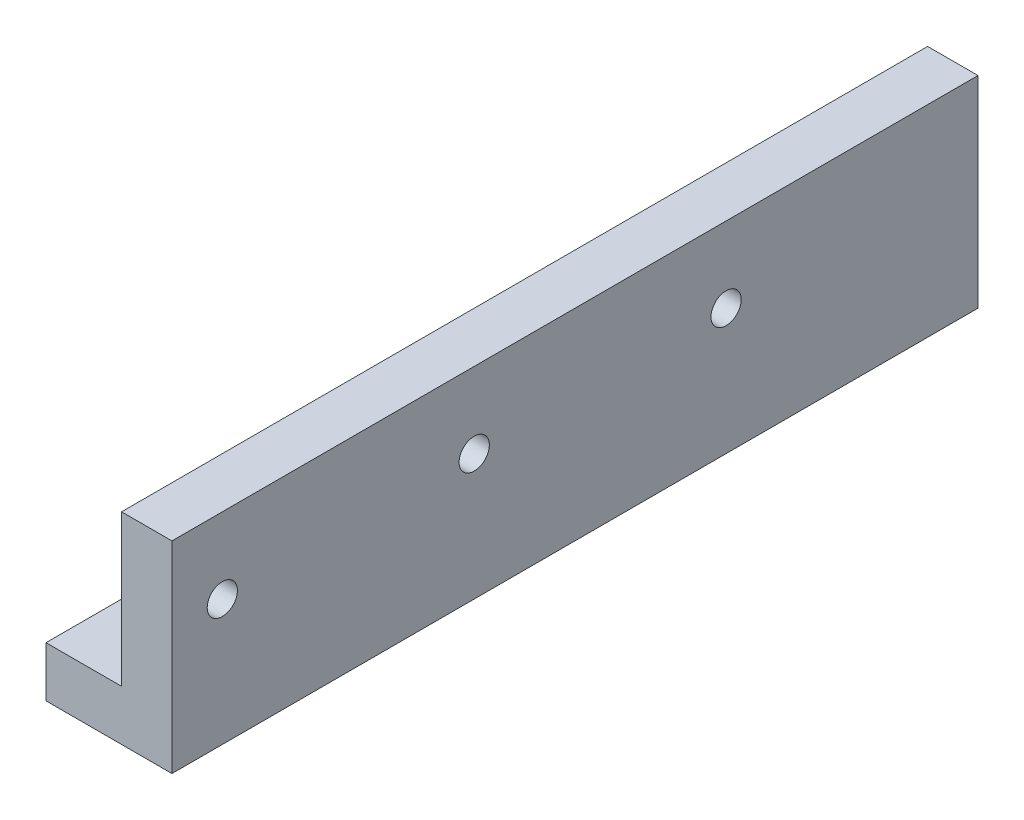
from build123d import *

# Parameters (mm, degrees)
EXTRUDE_1_DEPTH     = 160
CUT_EXTRUDE_START   = -10
SKETCH_2_R          = 3
CUT_EXTRUDE_1_DEPTH = 262.00066797
LPATTERN1_COUNT     = 3
LPATTERN1_PITCH     = 50


with BuildPart() as part:
    # 草圖1 → 填料-伸長1 (new body)
    with BuildSketch(Plane.XY):
        Polygon((-5.338534676, 191.77157068), (-5.338534676, 161.77157068), (-20.338534676, 161.77157068), (-20.338534676, 151.77157068), (4.661465324, 151.77157068), (4.661465324, 191.77157068), align=None)
    extrude(amount=-EXTRUDE_1_DEPTH)

    # 草圖2 → 除料-伸長1 (cut)
    with BuildSketch(Plane(origin=(4.661465324, 0, 0), x_dir=(0, 0, -1), z_dir=(1, 0, 0)).offset(CUT_EXTRUDE_START)):
        with Locations(Location((110, 176.77157068, 0), (0, 0, 90))):
            Circle(SKETCH_2_R)
    cut_extrude_1 = extrude(amount=CUT_EXTRUDE_1_DEPTH, mode=Mode.SUBTRACT)

    # LPattern1: 除料-伸長1 ×3
    with Locations(*[(0, 0, i * LPATTERN1_PITCH) for i in range(1, LPATTERN1_COUNT)]):
        add(cut_extrude_1, mode=Mode.SUBTRACT)


solid = part.part
